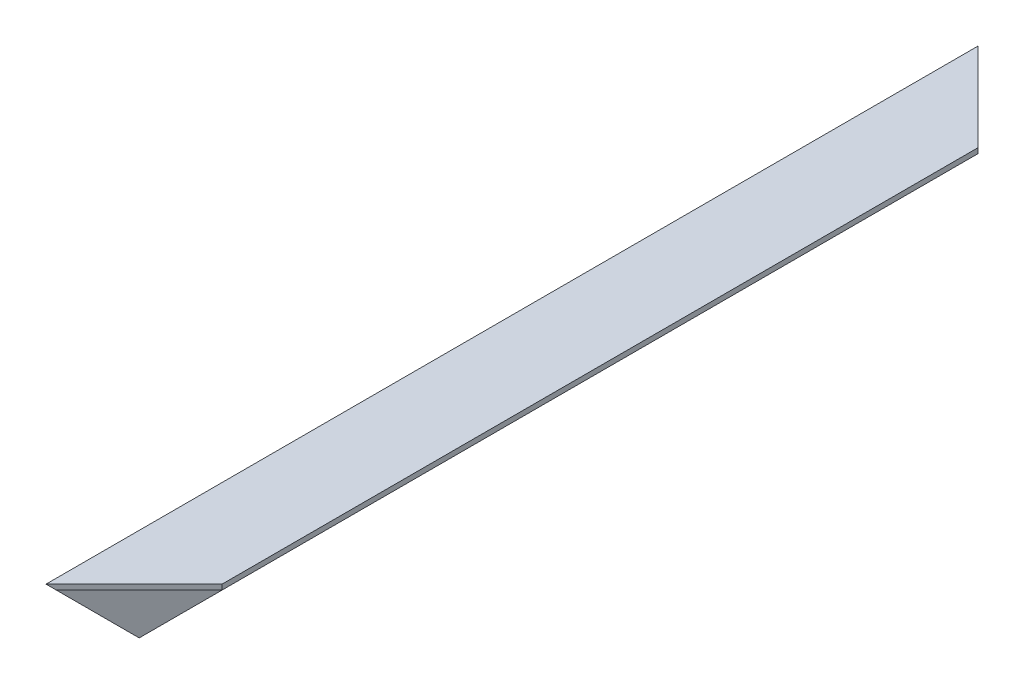
from build123d import *

# Parameters (mm, degrees)
BOSS_EXTRUDE1_DEPTH     = 225
CUT_EXTRUDE2_DEPTH      = 231.295675755
CUT_EXTRUDE2_DEPTH_BACK = 231.295675755
CUT_EXTRUDE3_DEPTH      = 231.06363453
CUT_EXTRUDE3_DEPTH_BACK = 231.06363453


with BuildPart() as part:
    # Sketch1 → Boss-Extrude1 (new, symmetric)
    with BuildSketch(Plane.XY):
        Polygon((-17.90633676, 20.183505355), (-17.90633676, -22.316494645), (-15.40633676, -22.316494645), (-15.40633676, 17.683505355), (24.59366324, 17.683505355), (24.59366324, 20.183505355), align=None)
    extrude(amount=BOSS_EXTRUDE1_DEPTH, both=True)

    # Sketch2 → Cut-Extrude2 (cut, two sides: drawn at the far end of the back side and taken through both)
    with BuildSketch(Plane(origin=(0, 20.183505355, 0), x_dir=(1, 0, 0), z_dir=(0, 1, 0)).offset(-CUT_EXTRUDE2_DEPTH_BACK)):
        Polygon((24.59366324, 182.5), (24.59366324, 225), (-17.90633676, 225), align=None)
        Polygon((24.59366324, -225), (-17.90633676, -225), (24.59366324, -182.5), align=None)
    extrude(amount=CUT_EXTRUDE2_DEPTH + CUT_EXTRUDE2_DEPTH_BACK, mode=Mode.SUBTRACT)

    # Sketch3 → Cut-Extrude3 (cut, two sides: drawn at the far end of the back side and taken through both)
    with BuildSketch(Plane.ZY.offset(17.90633676).offset(-CUT_EXTRUDE3_DEPTH_BACK)):
        Polygon((-225, 20.183505355), (-182.5, -22.316494645), (-225, -22.316494645), align=None)
        Polygon((182.5, -22.316494645), (225, -22.316494645), (225, 20.183505355), align=None)
    extrude(amount=CUT_EXTRUDE3_DEPTH + CUT_EXTRUDE3_DEPTH_BACK, mode=Mode.SUBTRACT)


solid = part.part
